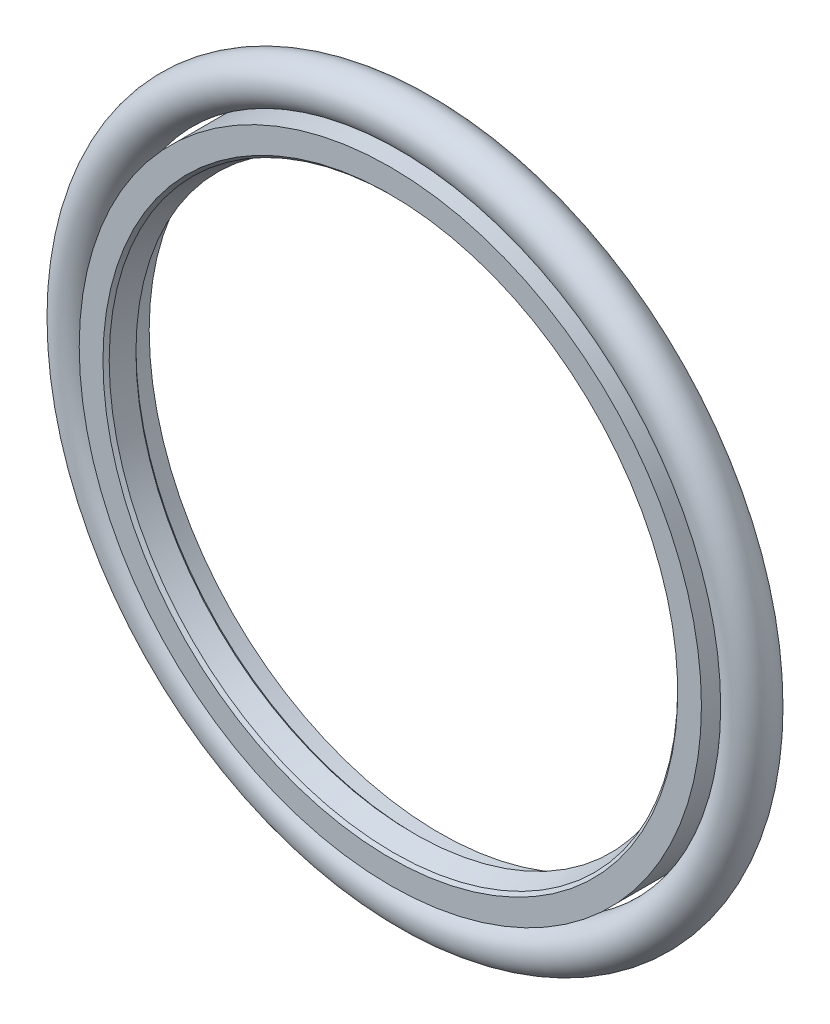
from build123d import *

# Parameters (mm, degrees)
SKETCH4_R = 1.765


with BuildPart() as part:
    # Sketch1 → Revolve1 (revolve)
    with BuildSketch(Plane(origin=(0, 0, 0), x_dir=(0, 0, -1), z_dir=(1, 0, 0))):
        with BuildLine():
            Line((0, 23.25), (0, 24.9))
            Line((0, 24.9), (-3.95, 24.9))
            Line((-3.95, 24.9), (-3.95, 23))
            Line((-3.95, 23), (-3.7, 22.751398318))
            Line((-3.7, 22.751398318), (-2.06, 22.25))
            Line((-2.06, 22.25), (-1.81, 22.5))
            Line((-1.81, 22.5), (-1.81, 23))
            ThreePointArc((-1.81, 23), (-1.736776695, 23.176776695), (-1.56, 23.25))
            Line((-1.56, 23.25), (0, 23.25))
        make_face()
    revolve(axis=Axis((0, 0, 0), (0, 0, 1)))


with BuildPart() as body_2:
    # Sketch4 → Revolve2 (revolve)
    with BuildSketch(Plane(origin=(0, 0, 0), x_dir=(0, 0, -1), z_dir=(1, 0, 0))):
        with Locations((-1.975, 26.96)):
            Circle(SKETCH4_R)
    revolve(axis=Axis((0, 0, 0), (0, 0, 1)))


solid = Compound([part.part, body_2.part])
